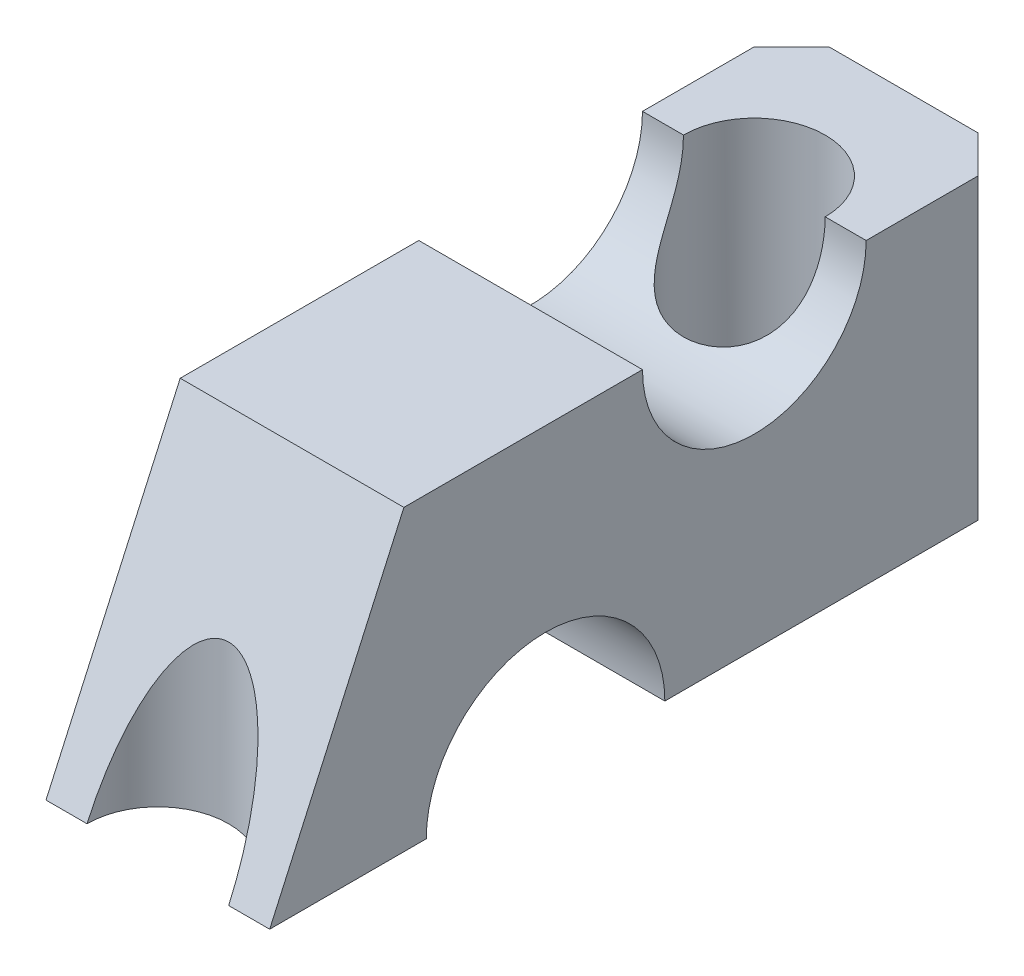
from build123d import *

# Parameters (mm, degrees)
SALIENTE_EXTRUIR1_DEPTH    = 30
CORTAR_EXTRUIR1_DEPTH      = 54
CORTAR_EXTRUIR1_DEPTH_BACK = 94
CROQUIS2_R                 = 9.5
CORTAR_EXTRUIR2_DEPTH      = 94
CORTAR_EXTRUIR2_DEPTH_BACK = 94
CROQUIS3_R                 = 15
CROQUIS3_R_2               = 16
CHAFL_N1_SIZE              = 5


with BuildPart() as part:
    # Croquis1 → Saliente-Extruir1 (new body)
    with BuildSketch(Plane(origin=(0, 0, 0), x_dir=(0, 0, -1), z_dir=(1, 0, 0))):
        Polygon((-100, 0), (-82, 40), (0, 40), (0, 0), align=None)
    extrude(amount=SALIENTE_EXTRUIR1_DEPTH)

    # Croquis2 → Cortar-Extruir1 (cut, two sides: drawn at the far end of the back side and taken through both)
    with BuildSketch(Plane(origin=(0, 40, 0), x_dir=(1, 0, 0), z_dir=(0, 1, 0)).offset(-CORTAR_EXTRUIR1_DEPTH_BACK)):
        with Locations((15, -100)):
            Circle(CROQUIS2_R)
        with Locations((15, -20)):
            Circle(CROQUIS2_R)
    extrude(amount=CORTAR_EXTRUIR1_DEPTH + CORTAR_EXTRUIR1_DEPTH_BACK, mode=Mode.SUBTRACT)

    # Croquis3 → Cortar-Extruir2 (cut, two sides: drawn at the far end of the back side and taken through both)
    with BuildSketch(Plane(origin=(30, 0, 0), x_dir=(0, 0, -1), z_dir=(1, 0, 0)).offset(-CORTAR_EXTRUIR2_DEPTH_BACK)):
        with Locations((-35, 40)):
            Circle(CROQUIS3_R)
        with Locations((-63, 0)):
            Circle(CROQUIS3_R_2)
    extrude(amount=CORTAR_EXTRUIR2_DEPTH + CORTAR_EXTRUIR2_DEPTH_BACK, mode=Mode.SUBTRACT)

    # Chaflán1
    chafl_n1_edges = [part.edges().sort_by_distance(p)[0] for p in [
        (0, 20, 0),
        (30, 20, 0),
    ]]
    chamfer(chafl_n1_edges, length=CHAFL_N1_SIZE)


solid = part.part
